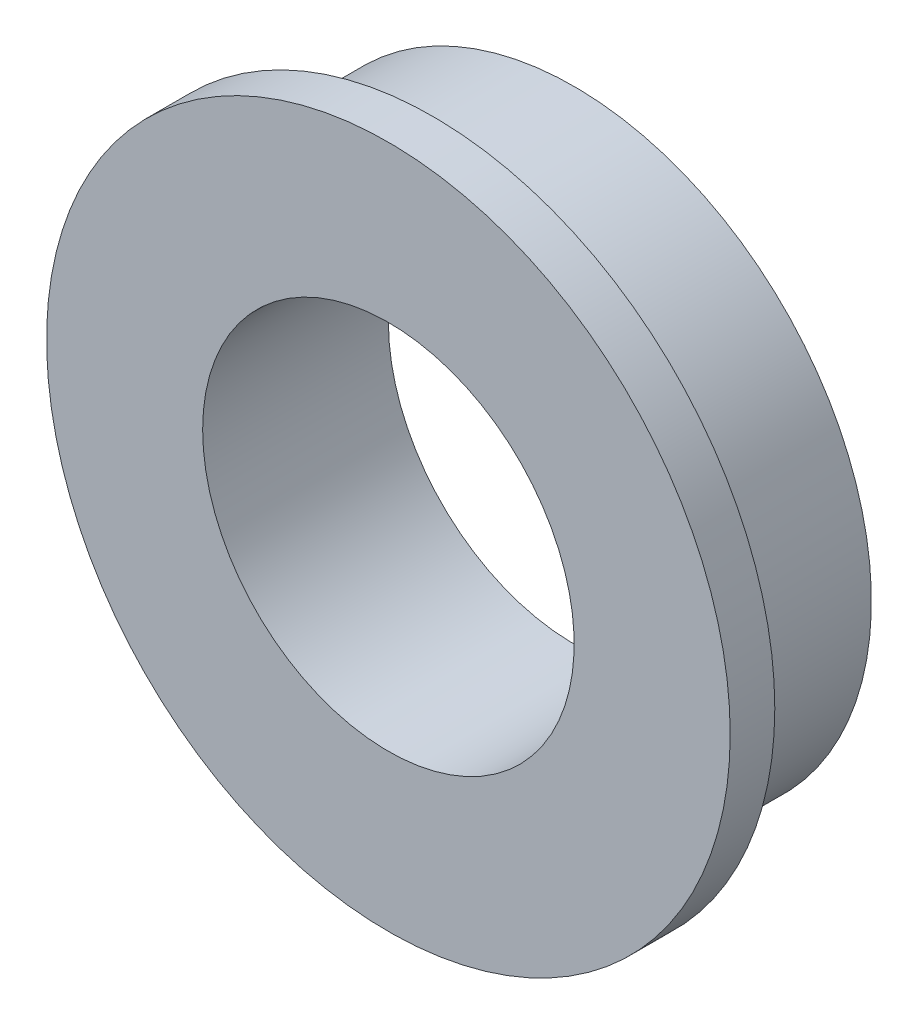
from build123d import *

# Parameters (mm, degrees)
SKETCH_1_R      = 4
SKETCH_1_R_2    = 2.5
EXTRUDE_1_DEPTH = 1.9
SKETCH_2_R      = 4.6
SKETCH_2_R_2    = 2.5
EXTRUDE_2_DEPTH = 0.6


with BuildPart() as part:
    # 草图1 → 凸台-拉伸1 (new body)
    with BuildSketch(Plane.XY):
        with Locations(Location((0, 0, 0), (0, 0, 180))):
            Circle(SKETCH_1_R)
        with Locations(Location((0, 0, 0), (0, 0, 180))):
            Circle(SKETCH_1_R_2, mode=Mode.SUBTRACT)
    extrude(amount=EXTRUDE_1_DEPTH)

    # 草图2 → 凸台-拉伸2 (add)
    with BuildSketch(Plane.XY.offset(1.9)):
        Circle(SKETCH_2_R)
        with Locations(Location((0, 0, 0), (0, 0, 180))):
            Circle(SKETCH_2_R_2, mode=Mode.SUBTRACT)
    extrude(amount=EXTRUDE_2_DEPTH)


solid = part.part
